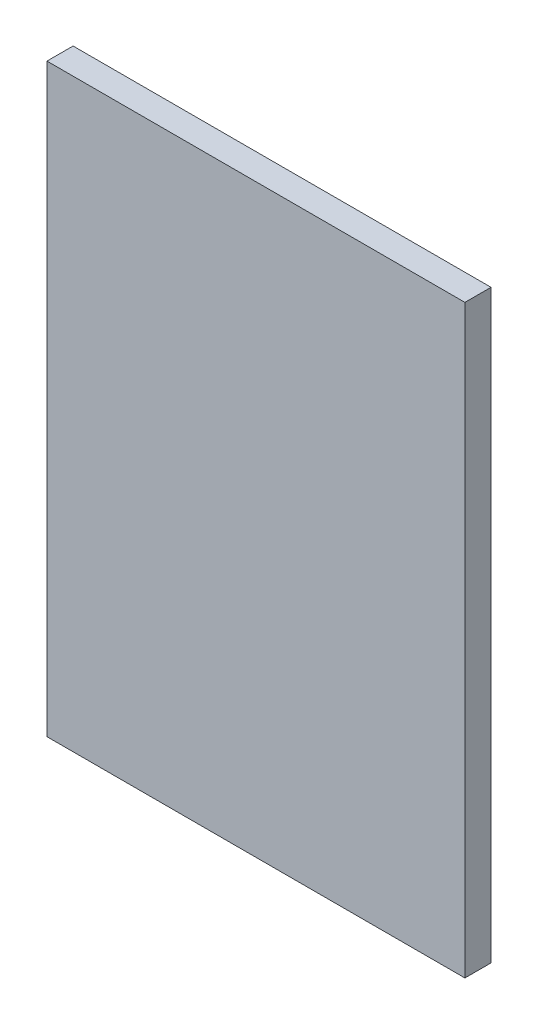
from build123d import *

# Parameters (mm, degrees)
SKETCH1_W           = 50.8
SKETCH1_H           = 71.12
BOSS_EXTRUDE1_DEPTH = 3.175


with BuildPart() as part:
    # Sketch1 → Boss-Extrude1 (new body)
    with BuildSketch(Plane.XY):
        Rectangle(SKETCH1_W, SKETCH1_H)
    extrude(amount=BOSS_EXTRUDE1_DEPTH)


solid = part.part
